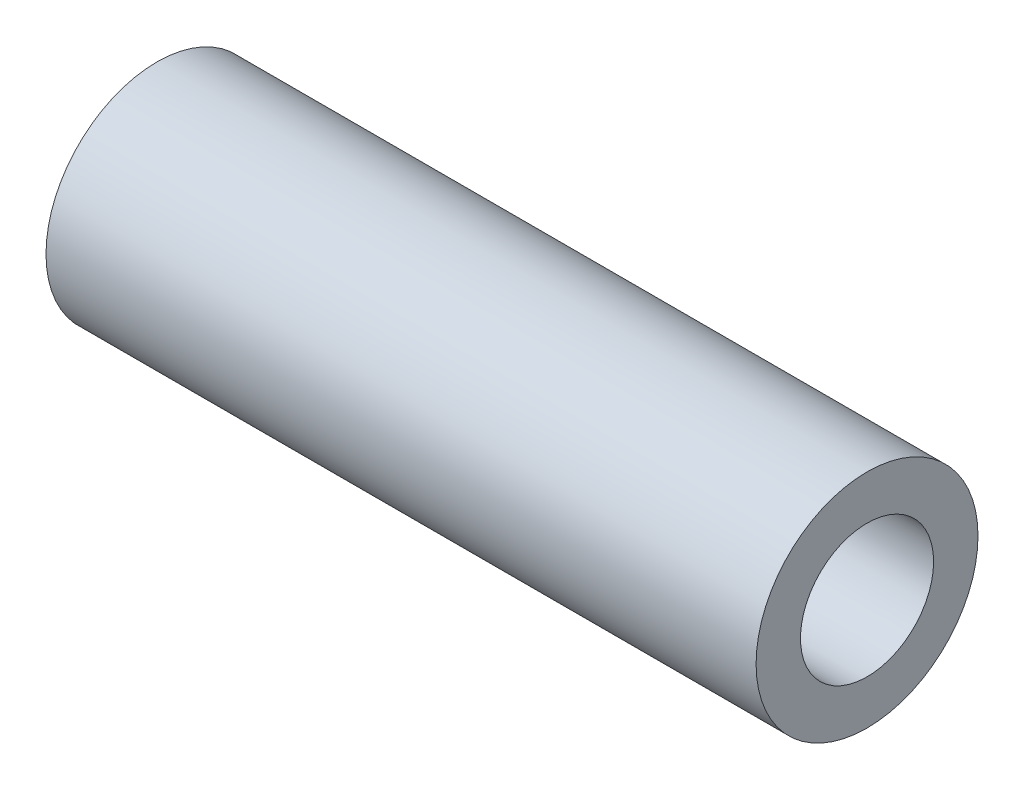
from build123d import *

# Parameters (mm, degrees)
SKETCH1_R           = 7.9375
SKETCH1_R_2         = 4.7625
BOSS_EXTRUDE1_DEPTH = 25.4


with BuildPart() as part:
    # Sketch1 → Boss-Extrude1 (new, symmetric)
    with BuildSketch(Plane(origin=(0, 0, 0), x_dir=(0, 0, -1), z_dir=(1, 0, 0))):
        Circle(SKETCH1_R)
        Circle(SKETCH1_R_2, mode=Mode.SUBTRACT)
    extrude(amount=BOSS_EXTRUDE1_DEPTH, both=True)


solid = part.part
